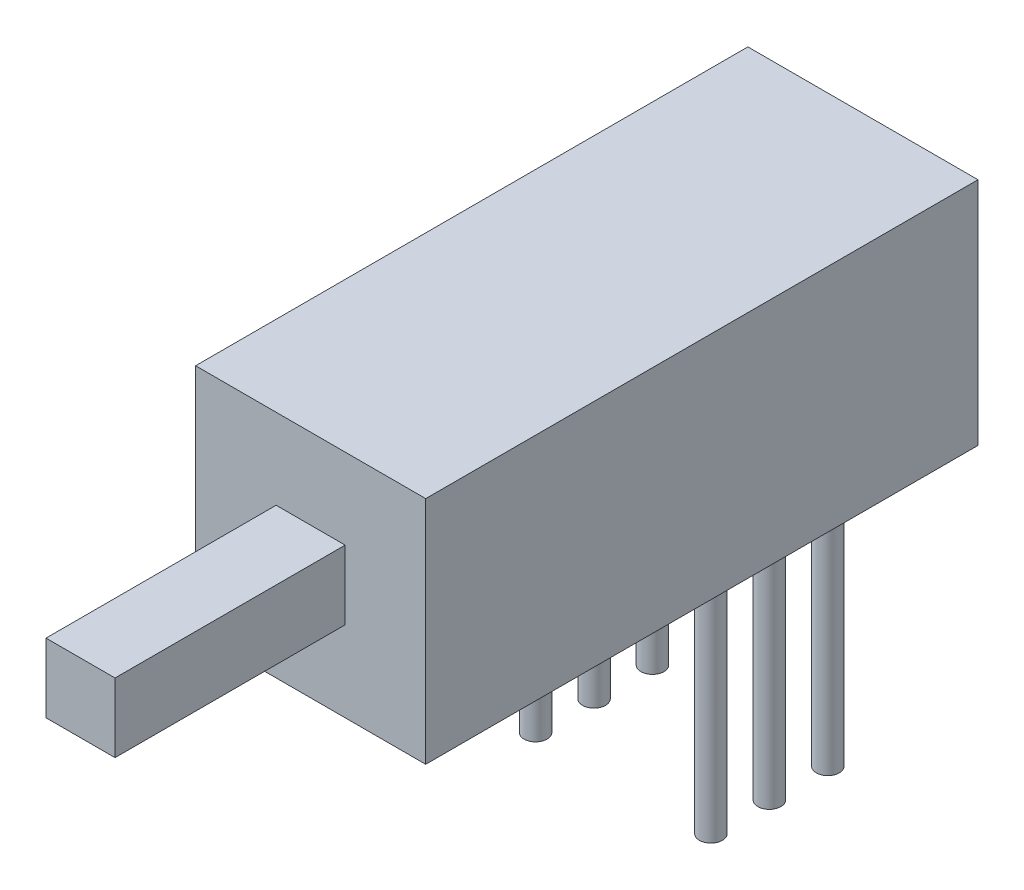
from build123d import *

# Parameters (mm, degrees)
SKETCH1_W           = 10
SKETCH1_H           = 10
BOSS_EXTRUDE1_DEPTH = 24
SKETCH2_W           = 3
SKETCH2_H           = 3
BOSS_EXTRUDE2_DEPTH = 10
SKETCH3_R           = 0.5
BOSS_EXTRUDE3_DEPTH = 10


with BuildPart() as part:
    # Sketch1 → Boss-Extrude1 (new body)
    with BuildSketch(Plane.XY):
        Rectangle(SKETCH1_W, SKETCH1_H)
    extrude(amount=BOSS_EXTRUDE1_DEPTH)

    # Sketch2 → Boss-Extrude2 (add)
    with BuildSketch(Plane.XY.offset(24)):
        Rectangle(SKETCH2_W, SKETCH2_H)
    extrude(amount=BOSS_EXTRUDE2_DEPTH)

    # Sketch3 → Boss-Extrude3 (add)
    with BuildSketch(Plane.XZ.offset(5)):
        with Locations(Location((-3.81, 10.415606067, 0), (0, 0, 90))):
            Circle(SKETCH3_R)
        with Locations(Location((3.81, 10.415606067, 0), (0, 0, 90))):
            Circle(SKETCH3_R)
        with Locations(Location((3.81, 7.875606067, 0), (0, 0, 90))):
            Circle(SKETCH3_R)
        with Locations(Location((3.81, 5.335606067, 0), (0, 0, 90))):
            Circle(SKETCH3_R)
        with Locations(Location((-3.81, 7.875606067, 0), (0, 0, 90))):
            Circle(SKETCH3_R)
        with Locations(Location((-3.81, 5.335606067, 0), (0, 0, 90))):
            Circle(SKETCH3_R)
    extrude(amount=BOSS_EXTRUDE3_DEPTH)


solid = part.part
